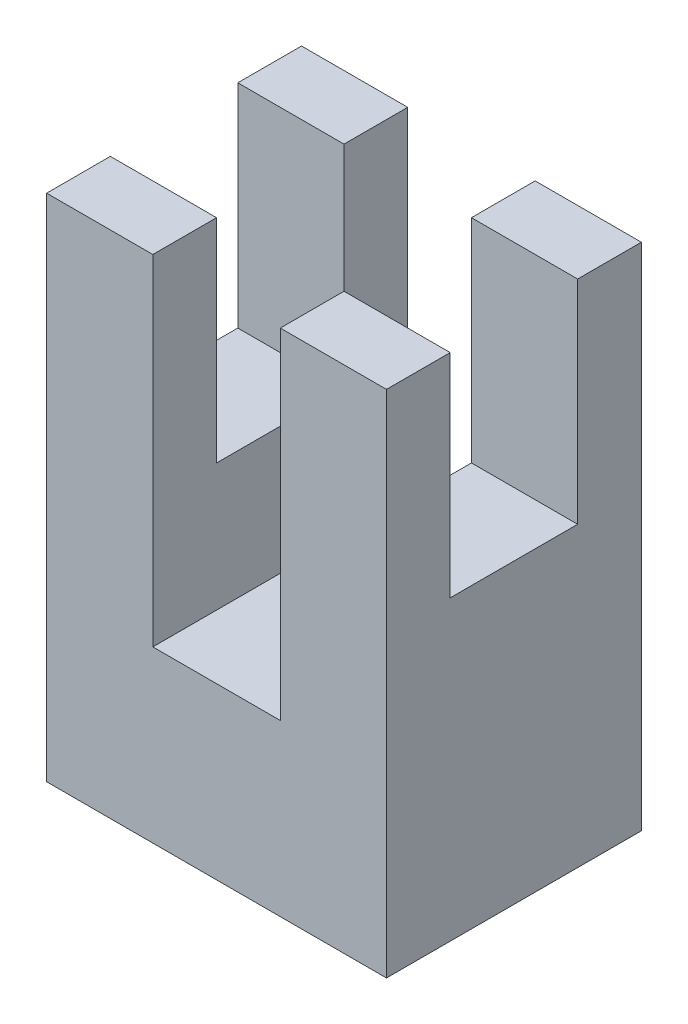
from build123d import *

# Parameters (mm, degrees)
SALIENTE_EXTRUIR1_DEPTH = 15
CORTAR_EXTRUIR1_REACH   = 75.655
CROQUIS2_W              = 15
CROQUIS2_H              = 25


with BuildPart() as part:
    # Croquis1 → Saliente-Extruir1 (new, symmetric)
    with BuildSketch(Plane.XY):
        Polygon((-20, 0), (20, 0), (20, 60), (7.5, 60), (7.5, 20), (-7.5, 20), (-7.5, 60), (-20, 60), align=None)
    extrude(amount=SALIENTE_EXTRUIR1_DEPTH, both=True)

    # Croquis2 → Cortar-Extruir1 (cut, up to next)
    with BuildSketch(Plane(origin=(20, 0, 0), x_dir=(0, 0, -1), z_dir=(1, 0, 0)), mode=Mode.PRIVATE) as cortar_extruir1_sk1:
        with Locations((0, 47.5)):
            Rectangle(CROQUIS2_W, CROQUIS2_H)
    cortar_extruir1_tool1 = extrude(cortar_extruir1_sk1.sketch, amount=-CORTAR_EXTRUIR1_REACH, mode=Mode.PRIVATE) & part.part
    cortar_extruir1 = cortar_extruir1_tool1.solids().sort_by_distance((20, 47.5, 0))[0]
    add(cortar_extruir1, mode=Mode.SUBTRACT)

    # Simetría1: Cortar-Extruir1 across plane
    add(cortar_extruir1.mirror(Plane(origin=(0, 0, 0), x_dir=(0, 0, 1), z_dir=(1, 0, 0))), mode=Mode.SUBTRACT)


solid = part.part
